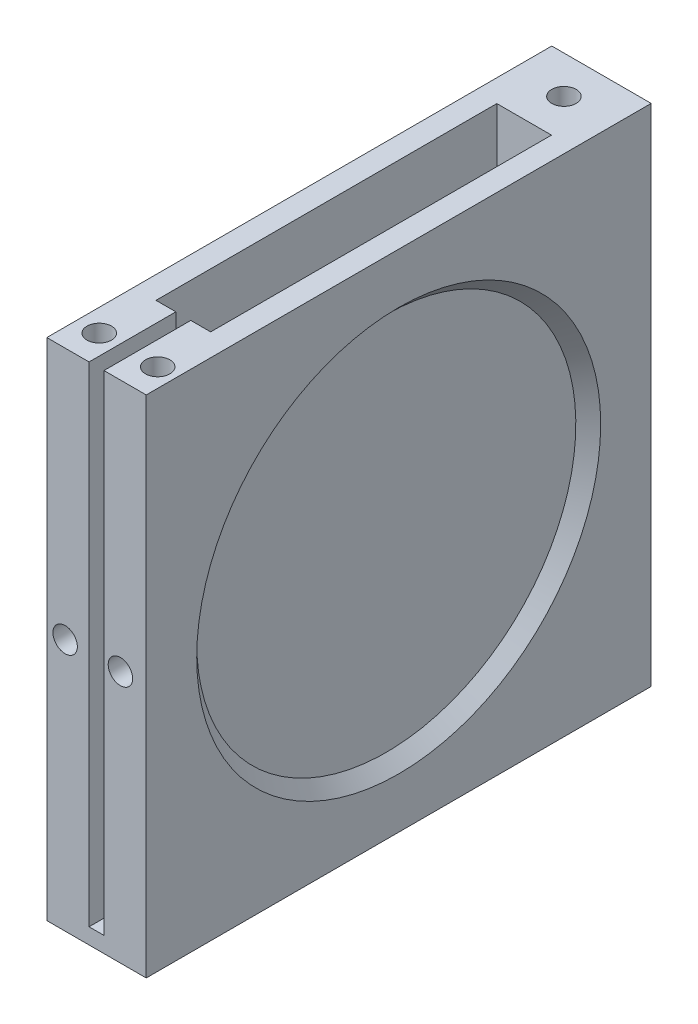
from build123d import *

# Parameters (mm, degrees)
SKETCH1_W                        = 20
SKETCH1_H                        = 101.6
BOSS_EXTRUDE1_DEPTH              = 101.6
SKETCH3_W                        = 11
SKETCH3_H                        = 68.58
CUT_EXTRUDE1_DEPTH               = 98.425
CUT_EXTRUDE2_REACH               = 116.032
SKETCH4_W                        = 3
SKETCH4_H                        = 98.425
SKETCH5_R                        = 40.64
CUT_EXTRUDE3_DEPTH               = 2.5
CUT_EXTRUDE3_DRAFT               = -45
SKETCH6_R                        = 40.64
CUT_EXTRUDE4_DEPTH               = 2.5
CUT_EXTRUDE4_DRAFT               = -45
F_10_0_1935_DIAMETER_HOLE1_D     = 4.9149
F_10_0_1935_DIAMETER_HOLE1_DEPTH = 7.62
F_10_0_1935_DIAMETER_HOLE1_TIP   = 1.476584928
CUT_EXTRUDE5_REACH               = 116.032
SKETCH9_R                        = 1.5
F_10_0_1935_DIAMETER_HOLE2_D     = 4.9149
F_10_0_1935_DIAMETER_HOLE2_DEPTH = 6.35
F_10_0_1935_DIAMETER_HOLE2_TIP   = 1.476584928
F_10_0_1935_DIAMETER_HOLE3_D     = 4.9149
F_10_0_1935_DIAMETER_HOLE3_DEPTH = 6.35
F_10_0_1935_DIAMETER_HOLE3_TIP   = 1.476584928


with BuildPart() as part:
    # Sketch1 → Boss-Extrude1 (new body)
    with BuildSketch(Plane.XY):
        Rectangle(SKETCH1_W, SKETCH1_H)
    extrude(amount=-BOSS_EXTRUDE1_DEPTH)

    # Sketch3 → Cut-Extrude1 (cut)
    with BuildSketch(Plane(origin=(0, 50.8, 0), x_dir=(1, 0, 0), z_dir=(0, 1, 0))):
        with Locations((0, 51.7525)):
            Rectangle(SKETCH3_W, SKETCH3_H)
    extrude(amount=-CUT_EXTRUDE1_DEPTH, mode=Mode.SUBTRACT)

    # Sketch4 → Cut-Extrude2 (cut, up to next)
    with BuildSketch(Plane.XY, mode=Mode.PRIVATE) as cut_extrude2_sk1:
        with Locations((0, 1.5875)):
            Rectangle(SKETCH4_W, SKETCH4_H)
    cut_extrude2_tool1 = extrude(cut_extrude2_sk1.sketch, amount=-CUT_EXTRUDE2_REACH, mode=Mode.PRIVATE) & part.part
    add(cut_extrude2_tool1.solids().sort_by_distance((0, 1.5875, 0))[0], mode=Mode.SUBTRACT)


with BuildPart() as cut_extrude3_tool:
    # Sketch5 → Cut-Extrude3 (with draft: the straight prism first)
    with BuildSketch(Plane(origin=(10, 0, 0), x_dir=(0, 0, -1), z_dir=(1, 0, 0))):
        with Locations((50.8, 0)):
            Circle(SKETCH5_R)
    extrude(amount=-CUT_EXTRUDE3_DEPTH)
    # Cut-Extrude3: the draft: its side faces are tilted about the plane it starts from
    cut_extrude3_sides = [cut_extrude3_tool.faces().sort_by_distance(p)[0] for p in [
        (8.75, 0, -10.16),
    ]]
    draft(cut_extrude3_sides, Plane(origin=(10, 0, 0), x_dir=(0, 0, -1), z_dir=(1, 0, 0)), CUT_EXTRUDE3_DRAFT)


with BuildPart() as part_1:
    add(part.part)

    # Cut-Extrude3: cut by cut_extrude3_tool
    add(cut_extrude3_tool.part, mode=Mode.SUBTRACT)


with BuildPart() as cut_extrude4_tool:
    # Sketch6 → Cut-Extrude4 (with draft: the straight prism first)
    with BuildSketch(Plane.ZY.offset(10)):
        with Locations((-50.8, 0)):
            Circle(SKETCH6_R)
    extrude(amount=-CUT_EXTRUDE4_DEPTH)
    # Cut-Extrude4: the draft: its side faces are tilted about the plane it starts from
    cut_extrude4_sides = [cut_extrude4_tool.faces().sort_by_distance(p)[0] for p in [
        (-8.75, 0, -91.44),
    ]]
    draft(cut_extrude4_sides, Plane.ZY.offset(10), CUT_EXTRUDE4_DRAFT)


with BuildPart() as part_2:
    add(part_1.part)

    # Cut-Extrude4: cut by cut_extrude4_tool
    add(cut_extrude4_tool.part, mode=Mode.SUBTRACT)

    # #10 (0.1935) Diameter Hole1
    with Locations(Plane(origin=(0, 50.8, 0), x_dir=(1, 0, 0), z_dir=(0, 1, 0))):
        with Locations((-5.494388528, 6.046802712), (6.262656147, 6.046802712), (0, 94.038956273)):
            Hole(F_10_0_1935_DIAMETER_HOLE1_D / 2, depth=F_10_0_1935_DIAMETER_HOLE1_DEPTH)
            with Locations((0, 0, -(F_10_0_1935_DIAMETER_HOLE1_DEPTH + F_10_0_1935_DIAMETER_HOLE1_TIP / 2))):  # 118° drill point
                Cone(0, F_10_0_1935_DIAMETER_HOLE1_D / 2, F_10_0_1935_DIAMETER_HOLE1_TIP, mode=Mode.SUBTRACT)

    # Sketch9 → Cut-Extrude5 (cut, up to next)
    with BuildSketch(Plane(origin=(0, 0, -101.6), x_dir=(-1, 0, 0), z_dir=(0, 0, -1)), mode=Mode.PRIVATE) as cut_extrude5_sk1:
        Circle(SKETCH9_R)
    cut_extrude5_tool1 = extrude(cut_extrude5_sk1.sketch, amount=-CUT_EXTRUDE5_REACH, mode=Mode.PRIVATE) & part_2.part
    add(cut_extrude5_tool1.solids().sort_by_distance((0, 0, -101.6))[0], mode=Mode.SUBTRACT)

    # #10 (0.1935) Diameter Hole2
    with Locations(Plane.XY):
        with Locations((4.80953422, 0), (-6.312598241, 0)):
            Hole(F_10_0_1935_DIAMETER_HOLE2_D / 2, depth=F_10_0_1935_DIAMETER_HOLE2_DEPTH)
            with Locations((0, 0, -(F_10_0_1935_DIAMETER_HOLE2_DEPTH + F_10_0_1935_DIAMETER_HOLE2_TIP / 2))):  # 118° drill point
                Cone(0, F_10_0_1935_DIAMETER_HOLE2_D / 2, F_10_0_1935_DIAMETER_HOLE2_TIP, mode=Mode.SUBTRACT)

    # #10 (0.1935) Diameter Hole3
    with Locations(Plane(origin=(0, 0, -101.6), x_dir=(-1, 0, 0), z_dir=(0, 0, -1))):
        with Locations((6.103302253, 0), (-5.068844244, 0)):
            Hole(F_10_0_1935_DIAMETER_HOLE3_D / 2, depth=F_10_0_1935_DIAMETER_HOLE3_DEPTH)
            with Locations((0, 0, -(F_10_0_1935_DIAMETER_HOLE3_DEPTH + F_10_0_1935_DIAMETER_HOLE3_TIP / 2))):  # 118° drill point
                Cone(0, F_10_0_1935_DIAMETER_HOLE3_D / 2, F_10_0_1935_DIAMETER_HOLE3_TIP, mode=Mode.SUBTRACT)


solid = part_2.part
